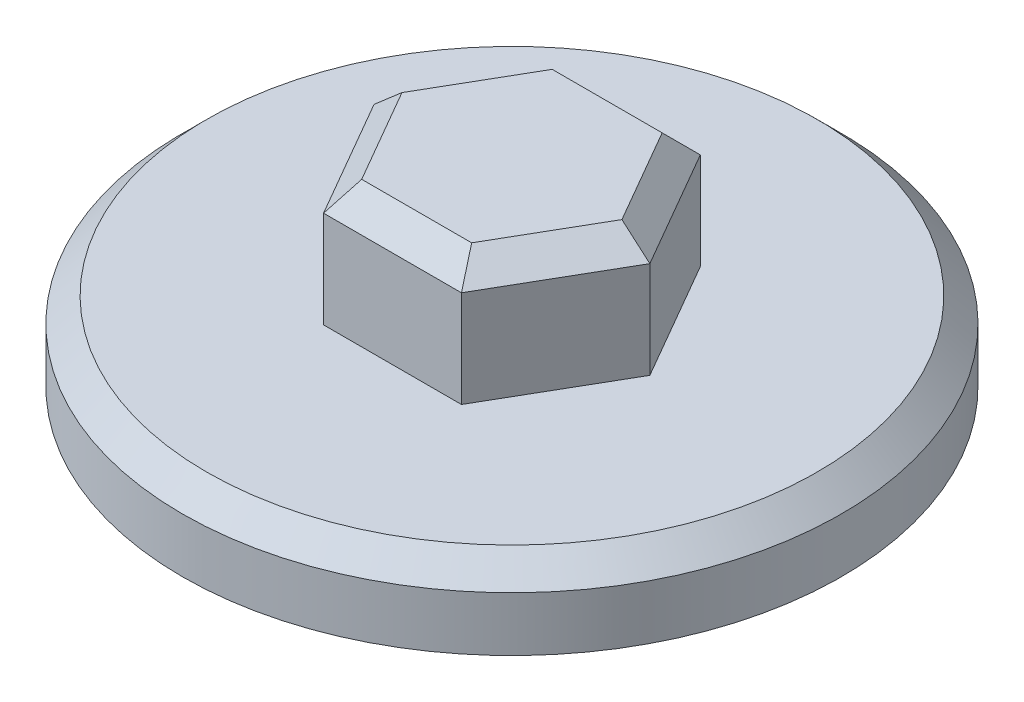
from build123d import *

# Parameters (mm, degrees)
SZKIC1_R                    = 5.45
DODANIE_WYCI_GNI_CIE1_DEPTH = 1.3
DODANIE_WYCI_GNI_CIE2_DEPTH = 2
SFAZOWANIE1_SIZE            = 0.4


with BuildPart() as part:
    # Szkic1 → Dodanie-wyciągnięcie1 (new body)
    with BuildSketch(Plane(origin=(0, 0, 0), x_dir=(1, 0, 0), z_dir=(0, 1, 0))):
        with Locations(Location((0, 0, 0), (0, 0, 270))):
            Circle(SZKIC1_R)
    extrude(amount=DODANIE_WYCI_GNI_CIE1_DEPTH)

    # Szkic2 → Dodanie-wyciągnięcie2 (add)
    with BuildSketch(Plane(origin=(0, 1.3, 0), x_dir=(1, 0, 0), z_dir=(0, 1, 0))):
        Polygon((2.280533563, 0), (1.140266782, 1.975), (-1.140266782, 1.975), (-2.280533563, 0), (-1.140266782, -1.975), (1.140266782, -1.975), align=None)
    extrude(amount=DODANIE_WYCI_GNI_CIE2_DEPTH)

    # Sfazowanie1
    sfazowanie1_edges = [part.edges().sort_by_distance(p)[0] for p in [
        (1.710400172, 3.3, 0.9875),
        (1.710400172, 3.3, -0.9875),
        (0, 3.3, -1.975),
        (-1.710400172, 3.3, -0.9875),
        (-1.710400172, 3.3, 0.9875),
        (0, 3.3, 1.975),
        (0, 1.3, -5.45),
    ]]
    chamfer(sfazowanie1_edges, length=SFAZOWANIE1_SIZE)


solid = part.part
